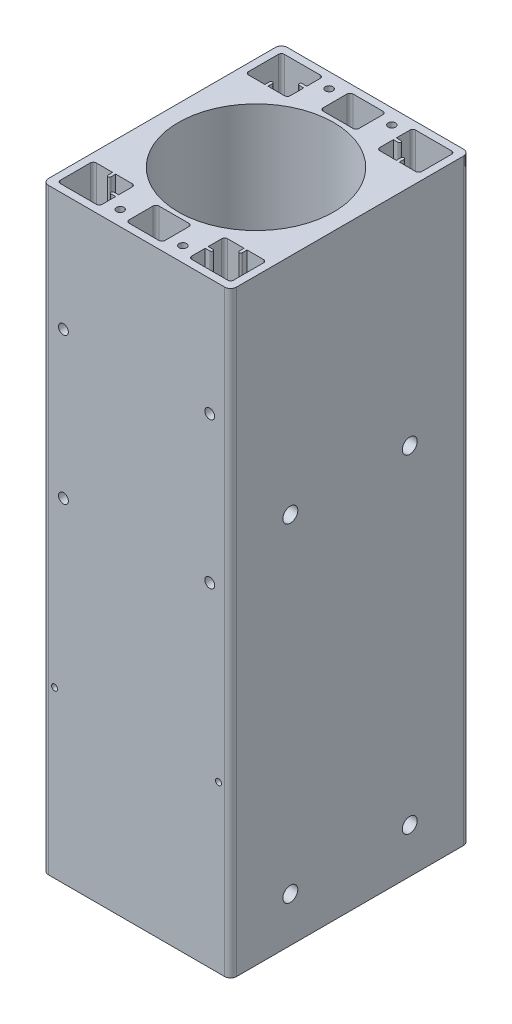
from build123d import *

# Parameters (mm, degrees)
SKICA1_R                   = 26
P_IDAT_VYSUNUT_M2_DEPTH    = 200
LINPOLE1_COUNT             = 2
LINPOLE1_PITCH             = 22
LINPOLE1_COUNT_DIR2        = 2
LINPOLE1_PITCH_DIR2        = 110
LINPOLE3_COUNT             = 2
LINPOLE3_PITCH             = 53
LINPOLE3_COUNT_DIR2        = 2
LINPOLE3_PITCH_DIR2        = 39
LINPOLE4_COUNT             = 2
LINPOLE4_PITCH             = 49
LINPOLE4_COUNT_DIR2        = 2
LINPOLE4_PITCH_DIR2        = 49
LINPOLE5_COUNT             = 2
LINPOLE5_PITCH             = 110
LINPOLE5_COUNT_DIR2        = 2
LINPOLE5_PITCH_DIR2        = 40
LINPOLE6_COUNT             = 2
LINPOLE6_PITCH             = 21
LINPOLE6_COUNT_DIR2        = 2
LINPOLE6_PITCH_DIR2        = 70
F_2_0_2_PR_M_R_D_RY1_D     = 2
F_2_0_2_PR_M_R_D_RY1_DEPTH = 5
F_2_0_2_PR_M_R_D_RY1_TIP   = 0.600860619


with BuildPart() as part:
    # Skica1 → Přidat vysunutím2 (new body)
    with BuildSketch(Plane(origin=(0, 0, 0), x_dir=(1, 0, 0), z_dir=(0, 1, 0))):
        with BuildLine():
            Line((-31.5, -38), (-31.5, 38))
            ThreePointArc((-31.5, 38), (-30.914213562, 39.414213562), (-29.5, 40))
            Line((-29.5, 40), (29.5, 40))
            ThreePointArc((29.5, 40), (30.914213562, 39.414213562), (31.5, 38))
            Line((31.5, 38), (31.5, -38))
            ThreePointArc((31.5, -38), (30.914213562, -39.414213562), (29.5, -40))
            Line((29.5, -40), (-29.5, -40))
            ThreePointArc((-29.5, -40), (-30.914213562, -39.414213562), (-31.5, -38))
        make_face()
        with Locations(Location((0, 0, 0), (0, 0, 270))):
            Circle(SKICA1_R, mode=Mode.SUBTRACT)
        with BuildLine():
            Line((28, -37.5), (16, -37.5))
            ThreePointArc((16, -37.5), (15.292893219, -37.207106781), (15, -36.5))
            Line((15, -36.5), (15, -32))
            Line((15, -32), (16.55, -32))
            ThreePointArc((16.55, -32), (17.05, -31.5), (16.55, -31))
            Line((16.55, -31), (15, -31))
            Line((15, -31), (15, -26.5))
            ThreePointArc((15, -26.5), (15.292893219, -25.792893219), (16, -25.5))
            Line((16, -25.5), (21.5, -25.5))
            Line((21.5, -25.5), (21.5, -27.05))
            ThreePointArc((21.5, -27.05), (22, -27.55), (22.5, -27.05))
            Line((22.5, -27.05), (22.5, -25.5))
            Line((22.5, -25.5), (28, -25.5))
            ThreePointArc((28, -25.5), (28.707106781, -25.792893219), (29, -26.5))
            Line((29, -26.5), (29, -36.5))
            ThreePointArc((29, -36.5), (28.707106781, -37.207106781), (28, -37.5))
        make_face(mode=Mode.SUBTRACT)
        with BuildLine():
            Line((-16, -37.5), (-28, -37.5))
            ThreePointArc((-28, -37.5), (-28.707106781, -37.207106781), (-29, -36.5))
            Line((-29, -36.5), (-29, -26.5))
            ThreePointArc((-29, -26.5), (-28.707106781, -25.792893219), (-28, -25.5))
            Line((-28, -25.5), (-22.5, -25.5))
            Line((-22.5, -25.5), (-22.5, -27.05))
            ThreePointArc((-22.5, -27.05), (-22, -27.55), (-21.5, -27.05))
            Line((-21.5, -27.05), (-21.5, -25.5))
            Line((-21.5, -25.5), (-16, -25.5))
            ThreePointArc((-16, -25.5), (-15.292893219, -25.792893219), (-15, -26.5))
            Line((-15, -26.5), (-15, -31))
            Line((-15, -31), (-16.55, -31))
            ThreePointArc((-16.55, -31), (-17.05, -31.5), (-16.55, -32))
            Line((-16.55, -32), (-15, -32))
            Line((-15, -32), (-15, -36.5))
            ThreePointArc((-15, -36.5), (-15.292893219, -37.207106781), (-16, -37.5))
        make_face(mode=Mode.SUBTRACT)
        with BuildLine():
            Line((5, -37.5), (-5, -37.5))
            ThreePointArc((-5, -37.5), (-5.707106781, -37.207106781), (-6, -36.5))
            Line((-6, -36.5), (-6, -28.5))
            ThreePointArc((-6, -28.5), (-5.707106781, -27.792893219), (-5, -27.5))
            Line((-5, -27.5), (5, -27.5))
            ThreePointArc((5, -27.5), (5.707106781, -27.792893219), (6, -28.5))
            Line((6, -28.5), (6, -36.5))
            ThreePointArc((6, -36.5), (5.707106781, -37.207106781), (5, -37.5))
        make_face(mode=Mode.SUBTRACT)
        with BuildLine():
            Line((28, 25.5), (22.5, 25.5))
            Line((22.5, 25.5), (22.5, 27.05))
            ThreePointArc((22.5, 27.05), (22, 27.55), (21.5, 27.05))
            Line((21.5, 27.05), (21.5, 25.5))
            Line((21.5, 25.5), (16, 25.5))
            ThreePointArc((16, 25.5), (15.292893219, 25.792893219), (15, 26.5))
            Line((15, 26.5), (15, 31))
            Line((15, 31), (16.55, 31))
            ThreePointArc((16.55, 31), (17.05, 31.5), (16.55, 32))
            Line((16.55, 32), (15, 32))
            Line((15, 32), (15, 36.5))
            ThreePointArc((15, 36.5), (15.292893219, 37.207106781), (16, 37.5))
            Line((16, 37.5), (28, 37.5))
            ThreePointArc((28, 37.5), (28.707106781, 37.207106781), (29, 36.5))
            Line((29, 36.5), (29, 26.5))
            ThreePointArc((29, 26.5), (28.707106781, 25.792893219), (28, 25.5))
        make_face(mode=Mode.SUBTRACT)
        with BuildLine():
            Line((-16, 25.5), (-21.5, 25.5))
            Line((-21.5, 25.5), (-21.5, 27.05))
            ThreePointArc((-21.5, 27.05), (-22, 27.55), (-22.5, 27.05))
            Line((-22.5, 27.05), (-22.5, 25.5))
            Line((-22.5, 25.5), (-28, 25.5))
            ThreePointArc((-28, 25.5), (-28.707106781, 25.792893219), (-29, 26.5))
            Line((-29, 26.5), (-29, 36.5))
            ThreePointArc((-29, 36.5), (-28.707106781, 37.207106781), (-28, 37.5))
            Line((-28, 37.5), (-16, 37.5))
            ThreePointArc((-16, 37.5), (-15.292893219, 37.207106781), (-15, 36.5))
            Line((-15, 36.5), (-15, 32))
            Line((-15, 32), (-16.55, 32))
            ThreePointArc((-16.55, 32), (-17.05, 31.5), (-16.55, 31))
            Line((-16.55, 31), (-15, 31))
            Line((-15, 31), (-15, 26.5))
            ThreePointArc((-15, 26.5), (-15.292893219, 25.792893219), (-16, 25.5))
        make_face(mode=Mode.SUBTRACT)
        with BuildLine():
            Line((5, 27.5), (-5, 27.5))
            ThreePointArc((-5, 27.5), (-5.707106781, 27.792893219), (-6, 28.5))
            Line((-6, 28.5), (-6, 36.5))
            ThreePointArc((-6, 36.5), (-5.707106781, 37.207106781), (-5, 37.5))
            Line((-5, 37.5), (5, 37.5))
            ThreePointArc((5, 37.5), (5.707106781, 37.207106781), (6, 36.5))
            Line((6, 36.5), (6, 28.5))
            ThreePointArc((6, 28.5), (5.707106781, 27.792893219), (5, 27.5))
        make_face(mode=Mode.SUBTRACT)
    extrude(amount=P_IDAT_VYSUNUT_M2_DEPTH)

    # Skica4 → M6 závit1 (revolve, cut)
    with BuildSketch(Plane(origin=(11, 13, -40), x_dir=(0, 1, 0), z_dir=(1, 0, 0))):
        Polygon((0, 0), (0, 17.502151548), (2.5, 16), (2.5, 0.525), (3.025, 0), align=None)
    m6_z_vit1 = revolve(axis=Axis((11, 13, -46.35), (0, 0, 1)), mode=Mode.SUBTRACT)

    # LinPole1: M6 z_vit1 2 × 2
    with Locations(*[(-i * LINPOLE1_PITCH, j * LINPOLE1_PITCH_DIR2, 0) for i in range(LINPOLE1_COUNT) for j in range(LINPOLE1_COUNT_DIR2) if (i, j) != (0, 0)]):
        add(m6_z_vit1, mode=Mode.SUBTRACT)

    # Skica9 → M4 závit2 (revolve, cut)
    with BuildSketch(Plane(origin=(-26.5, 0, -19.5), x_dir=(0, 0, -1), z_dir=(1, 0, 0))):
        Polygon((0, 0), (0, 12.491420021), (1.65, 11.5), (1.65, 0.375), (2.025, 0), align=None)
    m4_z_vit2 = revolve(axis=Axis((-26.5, -6.35, -19.5), (0, 1, 0)), mode=Mode.SUBTRACT)

    # LinPole3: M4 z_vit2 2 × 2
    with Locations(*[(i * LINPOLE3_PITCH, 0, j * LINPOLE3_PITCH_DIR2) for i in range(LINPOLE3_COUNT) for j in range(LINPOLE3_COUNT_DIR2) if (i, j) != (0, 0)]):
        add(m4_z_vit2, mode=Mode.SUBTRACT)

    # Skica11 → M4 závit3 (revolve, cut)
    with BuildSketch(Plane(origin=(-24.5, 111.75, 40), x_dir=(0, -1, 0), z_dir=(1, 0, 0))):
        Polygon((0, 0), (0, 12.491420021), (1.65, 11.5), (1.65, 0), align=None)
    m4_z_vit3 = revolve(axis=Axis((-24.5, 111.75, 46.35), (0, 0, -1)), mode=Mode.SUBTRACT)

    # LinPole4: M4 z_vit3 2 × 2
    with Locations(*[(i * LINPOLE4_PITCH, j * LINPOLE4_PITCH_DIR2, 0) for i in range(LINPOLE4_COUNT) for j in range(LINPOLE4_COUNT_DIR2) if (i, j) != (0, 0)]):
        add(m4_z_vit3, mode=Mode.SUBTRACT)

    # Skica13 → M6 závit2 (revolve, cut)
    with BuildSketch(Plane(origin=(31.5, 15, -20), x_dir=(0, 0, -1), z_dir=(0, 1, 0))):
        Polygon((0, 0), (0, 18.502151548), (2.5, 17), (2.5, 0), align=None)
    m6_z_vit2 = revolve(axis=Axis((37.85, 15, -20), (-1, 0, 0)), mode=Mode.SUBTRACT)

    # LinPole5: M6 z_vit2 2 × 2
    with Locations(*[(0, i * LINPOLE5_PITCH, j * LINPOLE5_PITCH_DIR2) for i in range(LINPOLE5_COUNT) for j in range(LINPOLE5_COUNT_DIR2) if (i, j) != (0, 0)]):
        add(m6_z_vit2, mode=Mode.SUBTRACT)

    # Skica15 → M3 závit1 (revolve, cut)
    with BuildSketch(Plane(origin=(-10.5, 200, 35), x_dir=(0, 0, 1), z_dir=(1, 0, 0))):
        Polygon((0, 0), (0, 9.251075774), (1.25, 8.5), (1.25, 0), align=None)
    m3_z_vit1 = revolve(axis=Axis((-10.5, 206.35, 35), (0, -1, 0)), mode=Mode.SUBTRACT)

    # LinPole6: M3 z_vit1 2 × 2
    with Locations(*[(i * LINPOLE6_PITCH, 0, -j * LINPOLE6_PITCH_DIR2) for i in range(LINPOLE6_COUNT) for j in range(LINPOLE6_COUNT_DIR2) if (i, j) != (0, 0)]):
        add(m3_z_vit1, mode=Mode.SUBTRACT)

    # Ø2.0 (2) průměr díry1
    with Locations(Plane.XY.offset(40)):
        with Locations((-27.447469829, 55.372412923), (27.423495206, 55.372412923)):
            Hole(F_2_0_2_PR_M_R_D_RY1_D / 2, depth=F_2_0_2_PR_M_R_D_RY1_DEPTH)
            with Locations((0, 0, -(F_2_0_2_PR_M_R_D_RY1_DEPTH + F_2_0_2_PR_M_R_D_RY1_TIP / 2))):  # 118° drill point
                Cone(0, F_2_0_2_PR_M_R_D_RY1_D / 2, F_2_0_2_PR_M_R_D_RY1_TIP, mode=Mode.SUBTRACT)


solid = part.part
